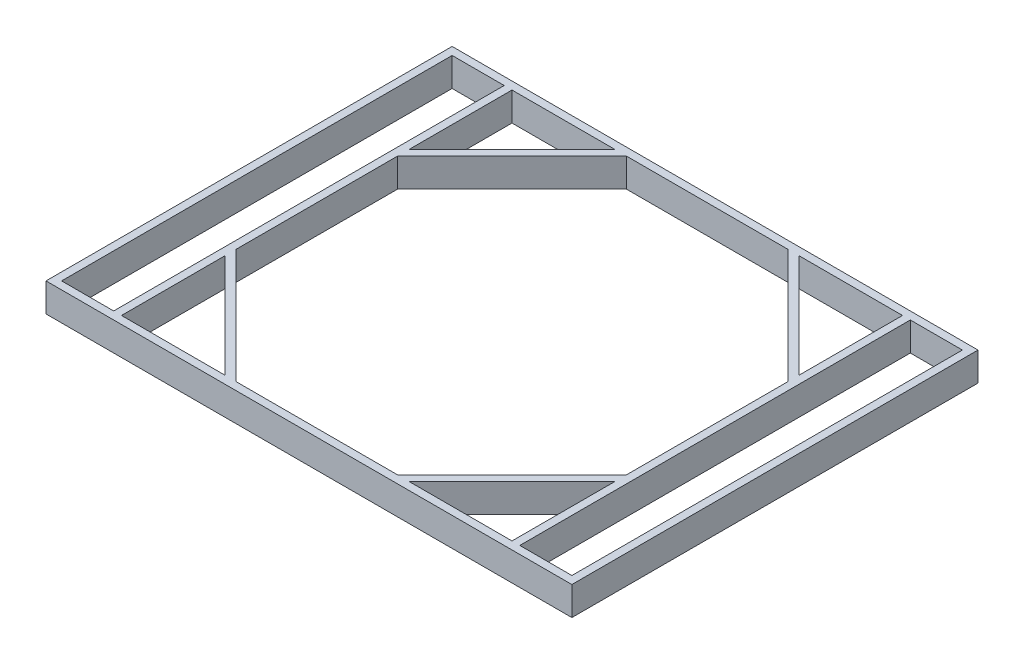
from build123d import *

# Parameters (mm, degrees)
SKETCH1_W           = 2565.4
SKETCH1_H           = 1981.2
SKETCH1_W_2         = 254
SKETCH1_H_2         = 1905
BOSS_EXTRUDE1_DEPTH = 139.7


with BuildPart() as part:
    # Sketch1 → Boss-Extrude1 (new body)
    with BuildSketch(Plane(origin=(0, 0, 0), x_dir=(1, 0, 0), z_dir=(0, 1, 0))):
        with Locations((1021.275844638, -968.102055566)):
            Rectangle(SKETCH1_W, SKETCH1_H)
        with Locations((2138.875844638, -968.102055566)):
            Rectangle(SKETCH1_W_2, SKETCH1_H_2, mode=Mode.SUBTRACT)
        Polygon((1469.695799525, -15.602055566), (1973.775844638, -15.602055566), (1973.775844638, -519.682100679), align=None, mode=Mode.SUBTRACT)
        Polygon((626.737426478, -15.602055566), (1415.814262798, -15.602055566), (1973.775844638, -573.563637405), (1973.775844638, -1362.640473726), (1415.814262798, -1920.602055566), (626.737426478, -1920.602055566), (68.775844638, -1362.640473726), (68.775844638, -573.563637405), align=None, mode=Mode.SUBTRACT)
        Polygon((68.775844638, -15.602055566), (572.855889751, -15.602055566), (68.775844638, -519.682100679), align=None, mode=Mode.SUBTRACT)
        with Locations((-96.324155362, -968.102055566)):
            Rectangle(SKETCH1_W_2, SKETCH1_H_2, mode=Mode.SUBTRACT)
        Polygon((1973.775844638, -1416.522010452), (1973.775844638, -1920.602055566), (1469.695799525, -1920.602055566), align=None, mode=Mode.SUBTRACT)
        Polygon((68.775844638, -1920.602055566), (68.775844638, -1416.522010452), (572.855889751, -1920.602055566), align=None, mode=Mode.SUBTRACT)
    extrude(amount=BOSS_EXTRUDE1_DEPTH)


solid = part.part
